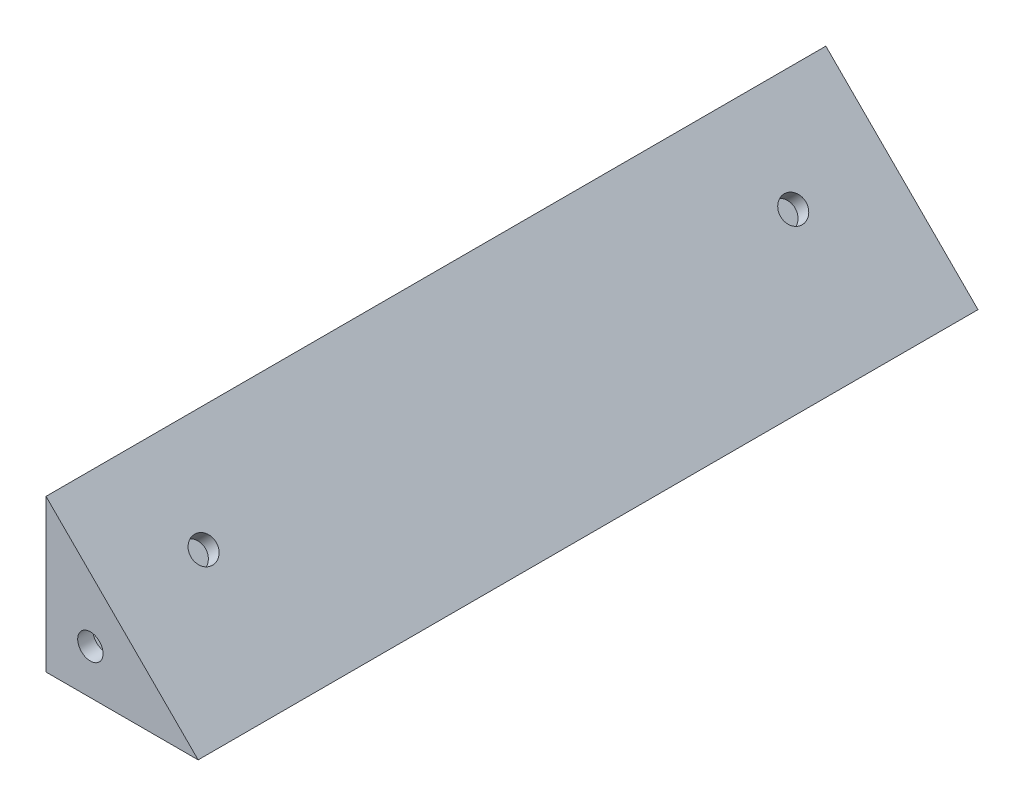
from build123d import *

# Parameters (mm, degrees)
BOSS_EXTRUDE1_DEPTH = 61.5
CUT_EXTRUDE1_DEPTH  = 3.2
SKETCH1_5_R         = 1
BOSS_EXTRUDE2_DEPTH = 1.2
CUT_EXTRUDE2_DEPTH  = 3.2
BOSS_EXTRUDE3_START = -1.2
SKETCH2_4_R         = 1
BOSS_EXTRUDE3_DEPTH = 1.2
CUT_EXTRUDE3_DEPTH  = 3.2
SKETCH4_3_R         = 1
BOSS_EXTRUDE4_DEPTH = 1.2
CUT_EXTRUDE4_DEPTH  = 64.798510954


with BuildPart() as part:
    # Sketch1 → Boss-Extrude1 (new body)
    with BuildSketch(Plane.XY):
        Polygon((12, 0), (0, 12), (0, 0), align=None)
    extrude(amount=BOSS_EXTRUDE1_DEPTH)

    # Sketch1<4> → Cut-Extrude1 (cut)
    with BuildSketch(Plane.XY):
        Polygon((10.535533906, 0), (4.247146227, 6.288387679), (1.458758548, 5.541241452), (0.711612321, 2.752853773), (3.464466094, 0), align=None)
    extrude(amount=CUT_EXTRUDE1_DEPTH, mode=Mode.SUBTRACT)

    # Sketch1<5> → Boss-Extrude2 (add)
    with BuildSketch(Plane.XY):
        Polygon((10.535533906, 0), (4.247146227, 6.288387679), (1.458758548, 5.541241452), (0.711612321, 2.752853773), (3.464466094, 0), align=None)
        with Locations((3.5, 3.5)):
            Circle(SKETCH1_5_R, mode=Mode.SUBTRACT)
    extrude(amount=BOSS_EXTRUDE2_DEPTH)

    # Sketch2 → Cut-Extrude2 (cut)
    with BuildSketch(Plane.XY.offset(61.5)):
        Polygon((0.711612321, 2.752853773), (3.464466094, 0), (10.535533906, 0), (4.247146227, 6.288387679), (1.458758548, 5.541241452), align=None)
    extrude(amount=-CUT_EXTRUDE2_DEPTH, mode=Mode.SUBTRACT)

    # Sketch2<4> → Boss-Extrude3 (add)
    with BuildSketch(Plane.XY.offset(61.5).offset(BOSS_EXTRUDE3_START)):
        Polygon((0.711612321, 2.752853773), (3.464466094, 0), (10.535533906, 0), (4.247146227, 6.288387679), (1.458758548, 5.541241452), align=None)
        with Locations((3.5, 3.5)):
            Circle(SKETCH2_4_R, mode=Mode.SUBTRACT)
    extrude(amount=BOSS_EXTRUDE3_DEPTH)

    # Sketch4 → Cut-Extrude3 (cut)
    with BuildSketch(Plane(origin=(6, 6, 0), x_dir=(0, 0, -1), z_dir=(0.7071067811865477, 0.7071067811865475, 0))):
        Polygon((-51.5, -8.485281374), (-51.5, 2.958094299), (-54, 4.401469972), (-56.5, 2.958094299), (-56.5, -8.485281374), align=None)
        Polygon((-5, -8.485281374), (-5, 2.958094299), (-7.5, 4.401469972), (-10, 2.958094299), (-10, -8.485281374), align=None)
    extrude(amount=-CUT_EXTRUDE3_DEPTH, mode=Mode.SUBTRACT)

    # Sketch4<3> → Boss-Extrude4 (add)
    # profile 1 of 2: a face of its own
    with BuildSketch(Plane(origin=(6, 6, 0), x_dir=(0, 0, -1), z_dir=(0.7071067811865477, 0.7071067811865475, 0))):
        Polygon((-51.5, -8.485281374), (-51.5, 2.958094299), (-54, 4.401469972), (-56.5, 2.958094299), (-56.5, -8.485281374), align=None)
        with Locations((-54, 1.514718626)):
            Circle(SKETCH4_3_R, mode=Mode.SUBTRACT)
    # profile 2 of 2: a face of its own
    with BuildSketch(Plane(origin=(6, 6, 0), x_dir=(0, 0, -1), z_dir=(0.7071067811865477, 0.7071067811865475, 0))):
        Polygon((-5, -8.485281374), (-5, 2.958094299), (-7.5, 4.401469972), (-10, 2.958094299), (-10, -8.485281374), align=None)
        with Locations((-7.5, 1.514718626)):
            Circle(SKETCH4_3_R, mode=Mode.SUBTRACT)
    extrude(amount=-BOSS_EXTRUDE4_DEPTH)

    # Sketch1<6> → Cut-Extrude4 (cut, through all)
    with BuildSketch(Plane.XY):
        Polygon((12, -2.237434652), (12, 0), (10.535533906, 0), (7, 0), (3.5, 0), (3.464466094, 0), (0, 0), (0, -2.237434652), align=None)
    extrude(amount=CUT_EXTRUDE4_DEPTH, mode=Mode.SUBTRACT)


solid = part.part
